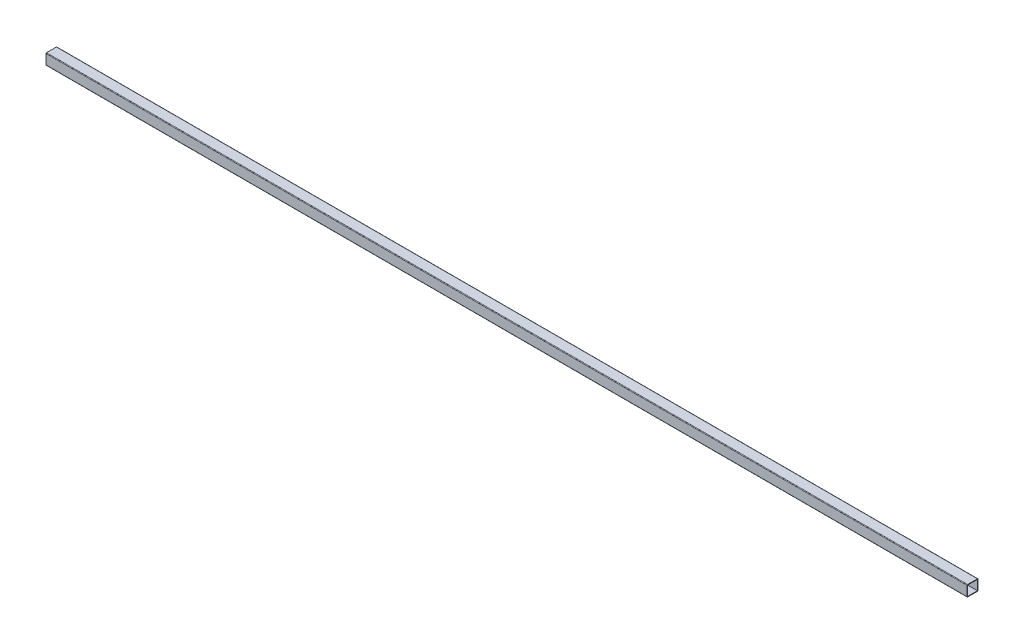
from build123d import *

# Parameters (mm, degrees)
F_8639_82_60_X_60_X_3_0_1_DEPTH = 5080


with BuildPart() as part:
    # Sketch1 → Квадратная труба гост 8639-82 _60 X 60 X 3.0(1) (new body)
    with BuildSketch(Plane.YZ):
        with BuildLine():
            Line((-26.999, -30), (26.999, -30))
            ThreePointArc((26.999, -30), (29.12102745, -29.12102745), (30, -26.999))
            Line((30, -26.999), (30, 26.999))
            ThreePointArc((30, 26.999), (29.12102745, 29.12102745), (26.999, 30))
            Line((26.999, 30), (-26.999, 30))
            ThreePointArc((-26.999, 30), (-29.12102745, 29.12102745), (-30, 26.999))
            Line((-30, 26.999), (-30, -26.999))
            ThreePointArc((-30, -26.999), (-29.12102745, -29.12102745), (-26.999, -30))
        make_face()
        with BuildLine():
            Line((-26.999, -27), (26.999, -27))
            ThreePointArc((26.999, -27), (26.999707107, -26.999707107), (27, -26.999))
            Line((27, -26.999), (27, 26.999))
            ThreePointArc((27, 26.999), (26.999707107, 26.999707107), (26.999, 27))
            Line((26.999, 27), (-26.999, 27))
            ThreePointArc((-26.999, 27), (-26.999707107, 26.999707107), (-27, 26.999))
            Line((-27, 26.999), (-27, -26.999))
            ThreePointArc((-27, -26.999), (-26.999707107, -26.999707107), (-26.999, -27))
        make_face(mode=Mode.SUBTRACT)
    extrude(amount=F_8639_82_60_X_60_X_3_0_1_DEPTH)


solid = part.part
